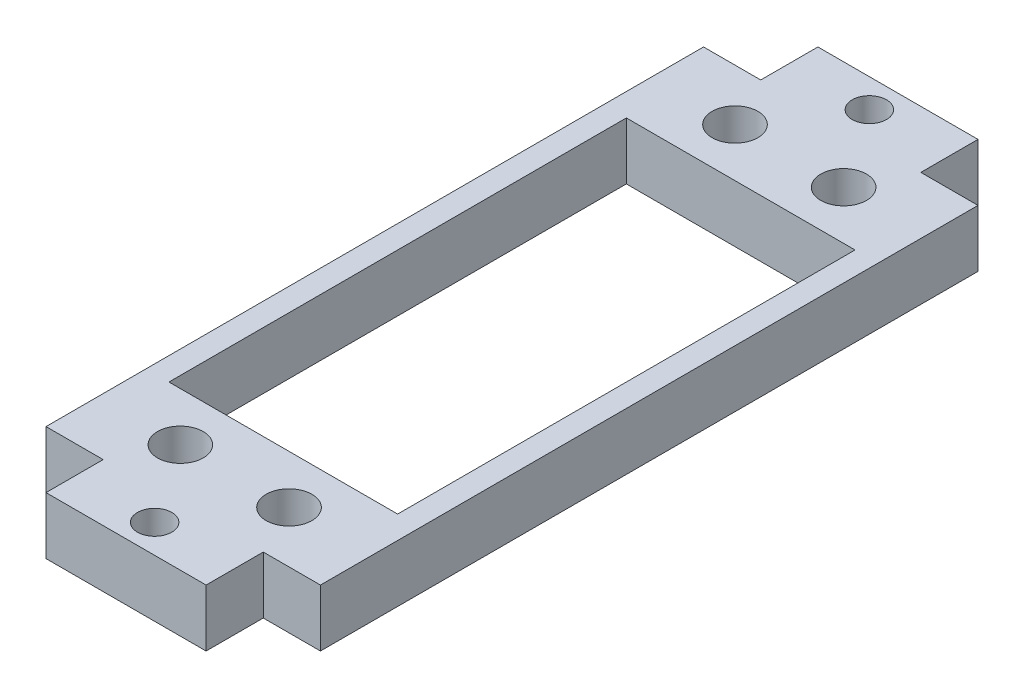
from build123d import *

# Parameters (mm, degrees)
SKETCH1_R           = 1.5
SKETCH1_R_2         = 2
SKETCH1_W           = 20
SKETCH1_H           = 40
BOSS_EXTRUDE1_DEPTH = 5


with BuildPart() as part:
    # Sketch1 → Boss-Extrude1 (new body)
    with BuildSketch(Plane(origin=(0, 0, 0), x_dir=(1, 0, 0), z_dir=(0, 1, 0))):
        Polygon((5, 0), (19, 0), (19, 5), (24, 5), (24, 62.5), (19, 62.5), (19, 67.5), (5, 67.5), (5, 62.5), (0, 62.5), (0, 5), (5, 5), align=None)
        with Locations(Location((12, 65, 0), (0, 0, 270))):
            Circle(SKETCH1_R, mode=Mode.SUBTRACT)
        with Locations(Location((12, 2.5, 0), (0, 0, 90))):
            Circle(SKETCH1_R, mode=Mode.SUBTRACT)
        with Locations(Location((16.75, 58, 0), (0, 0, 270))):
            Circle(SKETCH1_R_2, mode=Mode.SUBTRACT)
        with Locations(Location((7.25, 58, 0), (0, 0, 90))):
            Circle(SKETCH1_R_2, mode=Mode.SUBTRACT)
        with Locations(Location((16.75, 9.5, 0), (0, 0, 90))):
            Circle(SKETCH1_R_2, mode=Mode.SUBTRACT)
        with Locations(Location((7.25, 9.5, 0), (0, 0, 270))):
            Circle(SKETCH1_R_2, mode=Mode.SUBTRACT)
        with Locations((12, 33.75)):
            Rectangle(SKETCH1_W, SKETCH1_H, mode=Mode.SUBTRACT)
    extrude(amount=BOSS_EXTRUDE1_DEPTH)


solid = part.part
